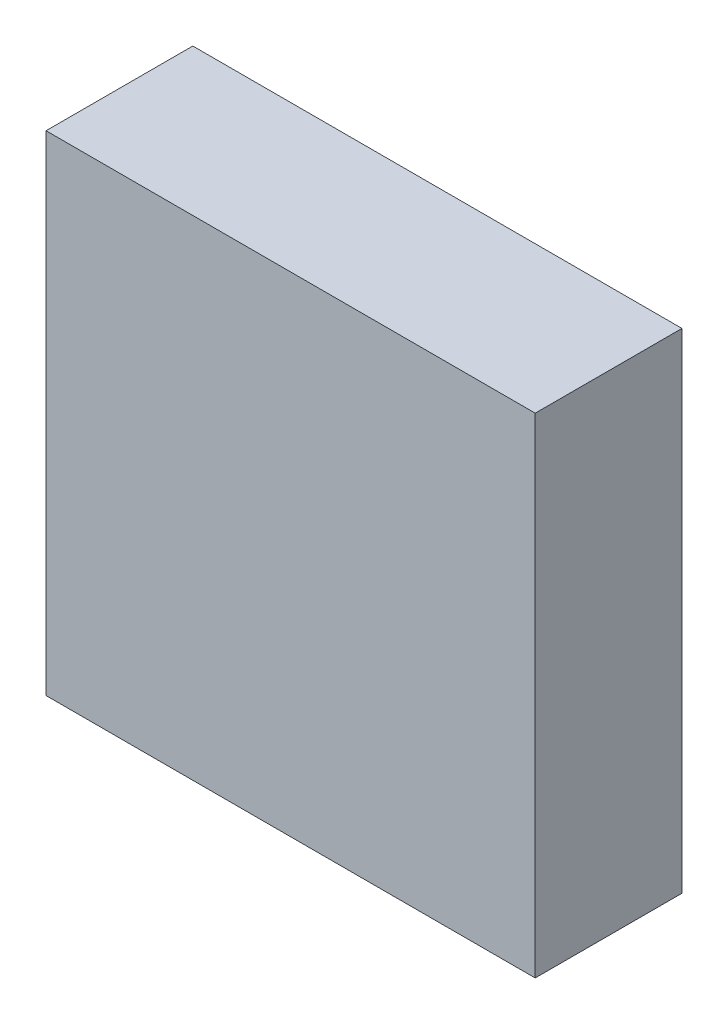
from build123d import *

# Parameters (mm, degrees)
SKETCH_1_W      = 100
SKETCH_1_H      = 100
EXTRUDE_1_DEPTH = 30


with BuildPart() as part:
    # Эскиз1 → Бобышка-Вытянуть1 (new body)
    with BuildSketch(Plane.XY):
        Rectangle(SKETCH_1_W, SKETCH_1_H)
    extrude(amount=EXTRUDE_1_DEPTH)


solid = part.part
